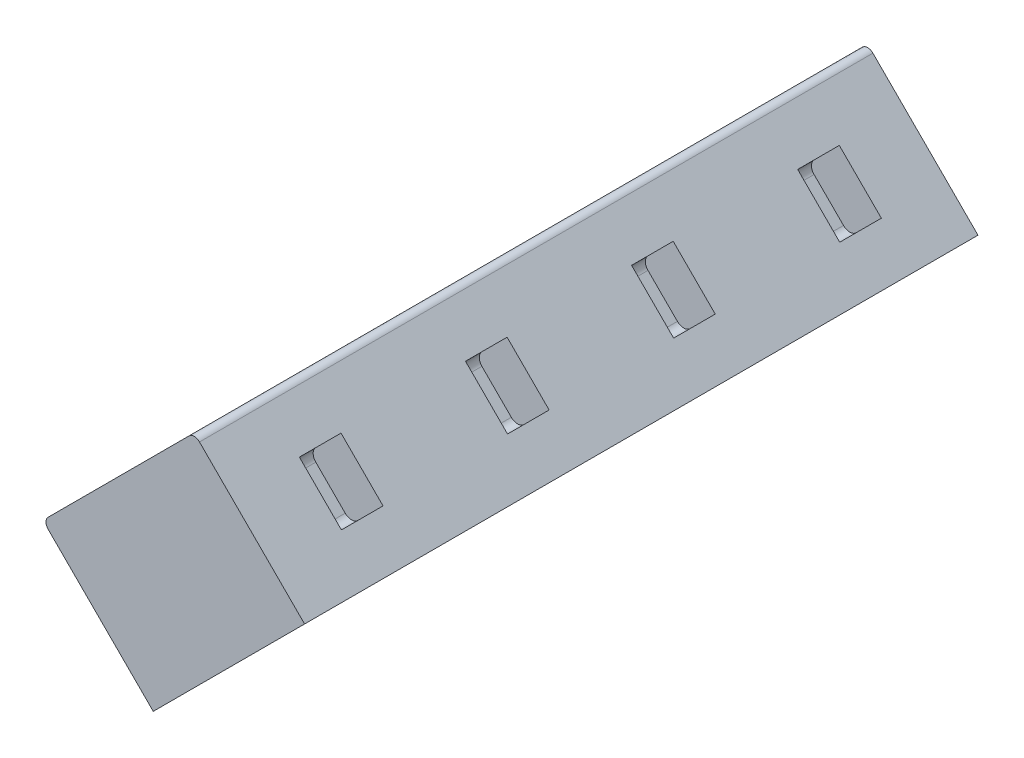
from build123d import *

# Parameters (mm, degrees)
HEAD_START           = -405
HEAD_CASTING_DEPTH   = 453.1
INTAKE_START         = -25.9
INTAKE_PORT_2_DEPTH  = 28
EXHAUST_START        = -27.9
EXHAUST_PORT_2_DEPTH = 32
INTAKE_START_2       = -137.66
INTAKE_PORT_4_DEPTH  = 28
EXHAUST_START_2      = -139.66
EXHAUST_PORT_4_DEPTH = 32
INTAKE_START_3       = -249.42
INTAKE_PORT_6_DEPTH  = 28
EXHAUST_START_3      = -251.42
EXHAUST_PORT_6_DEPTH = 32
INTAKE_START_4       = -361.18
INTAKE_PORT_8_DEPTH  = 28
EXHAUST_START_4      = -363.18
EXHAUST_PORT_8_DEPTH = 32


with BuildPart() as part:
    # Sketch1 → Head Casting (new body)
    with BuildSketch(Plane.XY.offset(HEAD_START)):
        with BuildLine():
            Line((-115.223049994, 217.046426485), (-217.046426485, 115.223049994))
            Line((-217.046426485, 115.223049994), (-287.757104604, 185.933728113))
            ThreePointArc((-287.757104604, 185.933728113), (-289.221570698, 189.469262019), (-287.757104604, 193.004795925))
            Line((-287.757104604, 193.004795925), (-193.004795925, 287.757104604))
            ThreePointArc((-193.004795925, 287.757104604), (-189.469262019, 289.221570698), (-185.933728113, 287.757104604))
            Line((-185.933728113, 287.757104604), (-115.223049994, 217.046426485))
        make_face()
    extrude(amount=HEAD_CASTING_DEPTH)

    # Sketch2 → Intake Port 2 (cut)
    with BuildSketch(Plane.XY.offset(INTAKE_START)):
        with BuildLine():
            Line((-135.729146649, 238.966736702), (-153.406816178, 221.289067172))
            ThreePointArc((-153.406816178, 221.289067172), (-157.649456866, 219.531707859), (-161.892097553, 221.289067172))
            Line((-161.892097553, 221.289067172), (-181.691087426, 241.088057046))
            ThreePointArc((-181.691087426, 241.088057046), (-183.448446739, 245.330697733), (-181.691087426, 249.57333842))
            Line((-181.691087426, 249.57333842), (-164.013417896, 267.251007949))
            Line((-164.013417896, 267.251007949), (-135.729146649, 238.966736702))
        make_face()
    extrude(amount=INTAKE_PORT_2_DEPTH, mode=Mode.SUBTRACT)

    # Sketch3 → Exhaust Port 2 (cut)
    with BuildSketch(Plane.XY.offset(EXHAUST_START)):
        with BuildLine():
            Line((-240.380950264, 137.143360211), (-224.117494297, 153.406816178))
            ThreePointArc((-224.117494297, 153.406816178), (-221.774348547, 159.063670428), (-224.117494297, 164.720524677))
            Line((-224.117494297, 164.720524677), (-238.259629921, 178.862660301))
            ThreePointArc((-238.259629921, 178.862660301), (-243.91648417, 181.205806052), (-249.57333842, 178.862660301))
            Line((-249.57333842, 178.862660301), (-265.836794387, 162.599204334))
            Line((-265.836794387, 162.599204334), (-240.380950264, 137.143360211))
        make_face()
    extrude(amount=EXHAUST_PORT_2_DEPTH, mode=Mode.SUBTRACT)

    # Sketch4 → Intake Port 4 (cut)
    with BuildSketch(Plane.XY.offset(INTAKE_START_2)):
        with BuildLine():
            Line((-135.729146649, 238.966736702), (-153.406816178, 221.289067172))
            ThreePointArc((-153.406816178, 221.289067172), (-157.649456866, 219.531707859), (-161.892097553, 221.289067172))
            Line((-161.892097553, 221.289067172), (-181.691087426, 241.088057046))
            ThreePointArc((-181.691087426, 241.088057046), (-183.448446739, 245.330697733), (-181.691087426, 249.57333842))
            Line((-181.691087426, 249.57333842), (-164.013417896, 267.251007949))
            Line((-164.013417896, 267.251007949), (-135.729146649, 238.966736702))
        make_face()
    extrude(amount=INTAKE_PORT_4_DEPTH, mode=Mode.SUBTRACT)

    # Sketch5 → Exhaust Port 4 (cut)
    with BuildSketch(Plane.XY.offset(EXHAUST_START_2)):
        with BuildLine():
            Line((-240.380950264, 137.143360211), (-224.117494297, 153.406816178))
            ThreePointArc((-224.117494297, 153.406816178), (-221.774348547, 159.063670428), (-224.117494297, 164.720524677))
            Line((-224.117494297, 164.720524677), (-238.259629921, 178.862660301))
            ThreePointArc((-238.259629921, 178.862660301), (-243.91648417, 181.205806052), (-249.57333842, 178.862660301))
            Line((-249.57333842, 178.862660301), (-265.836794387, 162.599204334))
            Line((-265.836794387, 162.599204334), (-240.380950264, 137.143360211))
        make_face()
    extrude(amount=EXHAUST_PORT_4_DEPTH, mode=Mode.SUBTRACT)

    # Sketch6 → Intake Port 6 (cut)
    with BuildSketch(Plane.XY.offset(INTAKE_START_3)):
        with BuildLine():
            Line((-135.729146649, 238.966736702), (-153.406816178, 221.289067172))
            ThreePointArc((-153.406816178, 221.289067172), (-157.649456866, 219.531707859), (-161.892097553, 221.289067172))
            Line((-161.892097553, 221.289067172), (-181.691087426, 241.088057046))
            ThreePointArc((-181.691087426, 241.088057046), (-183.448446739, 245.330697733), (-181.691087426, 249.57333842))
            Line((-181.691087426, 249.57333842), (-164.013417896, 267.251007949))
            Line((-164.013417896, 267.251007949), (-135.729146649, 238.966736702))
        make_face()
    extrude(amount=INTAKE_PORT_6_DEPTH, mode=Mode.SUBTRACT)

    # Sketch7 → Exhaust Port 6 (cut)
    with BuildSketch(Plane.XY.offset(EXHAUST_START_3)):
        with BuildLine():
            Line((-240.380950264, 137.143360211), (-224.117494297, 153.406816178))
            ThreePointArc((-224.117494297, 153.406816178), (-221.774348547, 159.063670428), (-224.117494297, 164.720524677))
            Line((-224.117494297, 164.720524677), (-238.259629921, 178.862660301))
            ThreePointArc((-238.259629921, 178.862660301), (-243.91648417, 181.205806052), (-249.57333842, 178.862660301))
            Line((-249.57333842, 178.862660301), (-265.836794387, 162.599204334))
            Line((-265.836794387, 162.599204334), (-240.380950264, 137.143360211))
        make_face()
    extrude(amount=EXHAUST_PORT_6_DEPTH, mode=Mode.SUBTRACT)

    # Sketch8 → Intake Port 8 (cut)
    with BuildSketch(Plane.XY.offset(INTAKE_START_4)):
        with BuildLine():
            Line((-135.729146649, 238.966736702), (-153.406816178, 221.289067172))
            ThreePointArc((-153.406816178, 221.289067172), (-157.649456866, 219.531707859), (-161.892097553, 221.289067172))
            Line((-161.892097553, 221.289067172), (-181.691087426, 241.088057046))
            ThreePointArc((-181.691087426, 241.088057046), (-183.448446739, 245.330697733), (-181.691087426, 249.57333842))
            Line((-181.691087426, 249.57333842), (-164.013417896, 267.251007949))
            Line((-164.013417896, 267.251007949), (-135.729146649, 238.966736702))
        make_face()
    extrude(amount=INTAKE_PORT_8_DEPTH, mode=Mode.SUBTRACT)

    # Sketch9 → Exhaust Port 8 (cut)
    with BuildSketch(Plane.XY.offset(EXHAUST_START_4)):
        with BuildLine():
            Line((-240.380950264, 137.143360211), (-224.117494297, 153.406816178))
            ThreePointArc((-224.117494297, 153.406816178), (-221.774348547, 159.063670428), (-224.117494297, 164.720524677))
            Line((-224.117494297, 164.720524677), (-238.259629921, 178.862660301))
            ThreePointArc((-238.259629921, 178.862660301), (-243.91648417, 181.205806052), (-249.57333842, 178.862660301))
            Line((-249.57333842, 178.862660301), (-265.836794387, 162.599204334))
            Line((-265.836794387, 162.599204334), (-240.380950264, 137.143360211))
        make_face()
    extrude(amount=EXHAUST_PORT_8_DEPTH, mode=Mode.SUBTRACT)


solid = part.part
